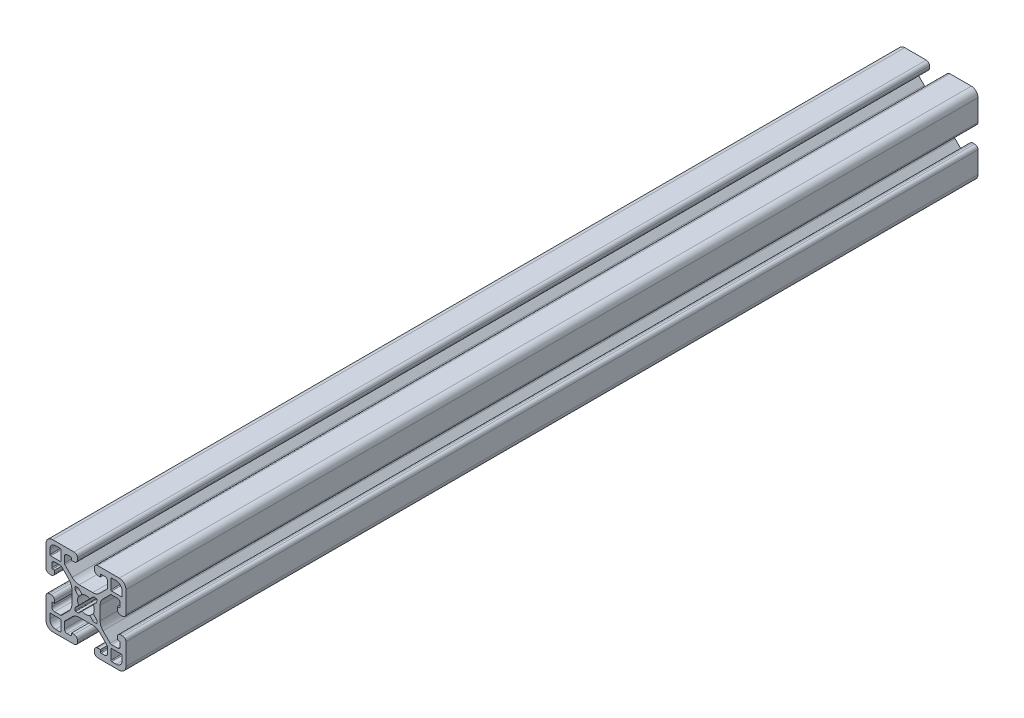
from build123d import *

# Parameters (mm, degrees)
EXTRUDE1_DEPTH      = 406.4
F_7060_RIGHT_D      = 6.6548
F_7060_RIGHT_DEPTH  = 20.1168
F_7060_RIGHT_TIP    = 1.999303624
F_7025_LEFT_D       = 7.9375
F_7025_LEFT_DEPTH   = 23.8252
F_7025_LEFT_TIP     = 2.384665582
SKETCH8_R           = 3.7465
F_7050_R_OPEN_DEPTH = 409.626323897
SKETCH9_R           = 3.7465
F_7050_S_OPEN_DEPTH = 409.626323897


with BuildPart() as part:
    # Sketch1 → Extrude1 (new body)
    with BuildSketch(Plane.XY):
        with BuildLine():
            Line((-16.285872595, 7.239), (-16.285872595, 9.017))
            ThreePointArc((-16.285872595, 9.017), (-15.913898208, 9.915025612), (-15.015872595, 10.287))
            Line((-15.015872595, 10.287), (-12.217800422, 10.287))
            ThreePointArc((-12.217800422, 10.287), (-11.877594851, 10.219328904), (-11.589182494, 10.026617928))
            Line((-11.589182494, 10.026617928), (-8.129198975, 6.56663441))
            ThreePointArc((-8.129198975, 6.56663441), (-7.09957176, 5.025688387), (-6.738014764, 3.20801862))
            Line((-6.738014764, 3.20801862), (-6.738014764, -3.20801862))
            ThreePointArc((-6.738014764, -3.20801862), (-7.09957176, -5.025688387), (-8.129198975, -6.56663441))
            Line((-8.129198975, -6.56663441), (-11.589182494, -10.026617928))
            ThreePointArc((-11.589182494, -10.026617928), (-11.877594851, -10.219328904), (-12.217800422, -10.287))
            Line((-12.217800422, -10.287), (-15.015872595, -10.287))
            ThreePointArc((-15.015872595, -10.287), (-15.913898208, -9.915025612), (-16.285872595, -9.017))
            Line((-16.285872595, -9.017), (-16.285872595, -7.239))
            ThreePointArc((-16.285872595, -7.239), (-16.174280279, -6.969592316), (-15.904872595, -6.858))
            Line((-15.904872595, -6.858), (-14.986, -6.858))
            Line((-14.986, -6.858), (-14.986, -5.6388))
            ThreePointArc((-14.986, -5.6388), (-15.447248241, -4.525248241), (-16.5608, -4.064))
            Line((-16.5608, -4.064), (-17.4752, -4.064))
            ThreePointArc((-17.4752, -4.064), (-18.588751759, -4.525248241), (-19.05, -5.6388))
            Line((-19.05, -5.6388), (-19.05, -15.875))
            ThreePointArc((-19.05, -15.875), (-18.12006403, -18.12006403), (-15.875, -19.05))
            Line((-15.875, -19.05), (-5.6388, -19.05))
            ThreePointArc((-5.6388, -19.05), (-4.525248241, -18.588751759), (-4.064, -17.4752))
            Line((-4.064, -17.4752), (-4.064, -16.5608))
            ThreePointArc((-4.064, -16.5608), (-4.525248241, -15.447248241), (-5.6388, -14.986))
            Line((-5.6388, -14.986), (-6.858, -14.986))
            Line((-6.858, -14.986), (-6.858, -15.904872595))
            ThreePointArc((-6.858, -15.904872595), (-6.969592316, -16.174280279), (-7.239, -16.285872595))
            Line((-7.239, -16.285872595), (-9.017, -16.285872595))
            ThreePointArc((-9.017, -16.285872595), (-9.915025612, -15.913898208), (-10.287, -15.015872595))
            Line((-10.287, -15.015872595), (-10.287, -12.217800422))
            ThreePointArc((-10.287, -12.217800422), (-10.219328904, -11.877594851), (-10.026617928, -11.589182494))
            Line((-10.026617928, -11.589182494), (-6.56663441, -8.129198975))
            ThreePointArc((-6.56663441, -8.129198975), (-5.025688387, -7.09957176), (-3.20801862, -6.738014764))
            Line((-3.20801862, -6.738014764), (3.20801862, -6.738014764))
            ThreePointArc((3.20801862, -6.738014764), (5.025688387, -7.09957176), (6.56663441, -8.129198975))
            Line((6.56663441, -8.129198975), (10.026617928, -11.589182494))
            ThreePointArc((10.026617928, -11.589182494), (10.219328904, -11.877594851), (10.287, -12.217800422))
            Line((10.287, -12.217800422), (10.287, -15.015872595))
            ThreePointArc((10.287, -15.015872595), (9.915025612, -15.913898208), (9.017, -16.285872595))
            Line((9.017, -16.285872595), (7.239, -16.285872595))
            ThreePointArc((7.239, -16.285872595), (6.969592316, -16.174280279), (6.858, -15.904872595))
            Line((6.858, -15.904872595), (6.858, -14.986))
            Line((6.858, -14.986), (5.6388, -14.986))
            ThreePointArc((5.6388, -14.986), (4.525248241, -15.447248241), (4.064, -16.5608))
            Line((4.064, -16.5608), (4.064, -17.4752))
            ThreePointArc((4.064, -17.4752), (4.525248241, -18.588751759), (5.6388, -19.05))
            Line((5.6388, -19.05), (15.875, -19.05))
            ThreePointArc((15.875, -19.05), (18.12006403, -18.12006403), (19.05, -15.875))
            Line((19.05, -15.875), (19.05, -5.6388))
            ThreePointArc((19.05, -5.6388), (18.588751759, -4.525248241), (17.4752, -4.064))
            Line((17.4752, -4.064), (16.5608, -4.064))
            ThreePointArc((16.5608, -4.064), (15.447248241, -4.525248241), (14.986, -5.6388))
            Line((14.986, -5.6388), (14.986, -6.858))
            Line((14.986, -6.858), (15.904872595, -6.858))
            ThreePointArc((15.904872595, -6.858), (16.174280279, -6.969592316), (16.285872595, -7.239))
            Line((16.285872595, -7.239), (16.285872595, -9.017))
            ThreePointArc((16.285872595, -9.017), (15.913898208, -9.915025612), (15.015872595, -10.287))
            Line((15.015872595, -10.287), (12.217800422, -10.287))
            ThreePointArc((12.217800422, -10.287), (11.877594851, -10.219328904), (11.589182494, -10.026617928))
            Line((11.589182494, -10.026617928), (8.129198975, -6.56663441))
            ThreePointArc((8.129198975, -6.56663441), (7.09957176, -5.025688387), (6.738014764, -3.20801862))
            Line((6.738014764, -3.20801862), (6.738014764, 3.20801862))
            ThreePointArc((6.738014764, 3.20801862), (7.09957176, 5.025688387), (8.129198975, 6.56663441))
            Line((8.129198975, 6.56663441), (11.589182494, 10.026617928))
            ThreePointArc((11.589182494, 10.026617928), (11.877594851, 10.219328904), (12.217800422, 10.287))
            Line((12.217800422, 10.287), (15.015872595, 10.287))
            ThreePointArc((15.015872595, 10.287), (15.913898208, 9.915025612), (16.285872595, 9.017))
            Line((16.285872595, 9.017), (16.285872595, 7.239))
            ThreePointArc((16.285872595, 7.239), (16.174280279, 6.969592316), (15.904872595, 6.858))
            Line((15.904872595, 6.858), (14.986, 6.858))
            Line((14.986, 6.858), (14.986, 5.6388))
            ThreePointArc((14.986, 5.6388), (15.447248241, 4.525248241), (16.5608, 4.064))
            Line((16.5608, 4.064), (17.4752, 4.064))
            ThreePointArc((17.4752, 4.064), (18.588751759, 4.525248241), (19.05, 5.6388))
            Line((19.05, 5.6388), (19.05, 15.875))
            ThreePointArc((19.05, 15.875), (18.12006403, 18.12006403), (15.875, 19.05))
            Line((15.875, 19.05), (5.6388, 19.05))
            ThreePointArc((5.6388, 19.05), (4.525248241, 18.588751759), (4.064, 17.4752))
            Line((4.064, 17.4752), (4.064, 16.5608))
            ThreePointArc((4.064, 16.5608), (4.525248241, 15.447248241), (5.6388, 14.986))
            Line((5.6388, 14.986), (6.858, 14.986))
            Line((6.858, 14.986), (6.858, 15.904872595))
            ThreePointArc((6.858, 15.904872595), (6.969592316, 16.174280279), (7.239, 16.285872595))
            Line((7.239, 16.285872595), (9.017, 16.285872595))
            ThreePointArc((9.017, 16.285872595), (9.915025612, 15.913898208), (10.287, 15.015872595))
            Line((10.287, 15.015872595), (10.287, 12.217800422))
            ThreePointArc((10.287, 12.217800422), (10.219328904, 11.877594851), (10.026617928, 11.589182494))
            Line((10.026617928, 11.589182494), (6.56663441, 8.129198975))
            ThreePointArc((6.56663441, 8.129198975), (5.025688387, 7.09957176), (3.20801862, 6.738014764))
            Line((3.20801862, 6.738014764), (-3.20801862, 6.738014764))
            ThreePointArc((-3.20801862, 6.738014764), (-5.025688387, 7.09957176), (-6.56663441, 8.129198975))
            Line((-6.56663441, 8.129198975), (-10.026617928, 11.589182494))
            ThreePointArc((-10.026617928, 11.589182494), (-10.219328904, 11.877594851), (-10.287, 12.217800422))
            Line((-10.287, 12.217800422), (-10.287, 15.015872595))
            ThreePointArc((-10.287, 15.015872595), (-9.915025612, 15.913898208), (-9.017, 16.285872595))
            Line((-9.017, 16.285872595), (-7.239, 16.285872595))
            ThreePointArc((-7.239, 16.285872595), (-6.969592316, 16.174280279), (-6.858, 15.904872595))
            Line((-6.858, 15.904872595), (-6.858, 14.986))
            Line((-6.858, 14.986), (-5.6388, 14.986))
            ThreePointArc((-5.6388, 14.986), (-4.525248241, 15.447248241), (-4.064, 16.5608))
            Line((-4.064, 16.5608), (-4.064, 17.4752))
            ThreePointArc((-4.064, 17.4752), (-4.525248241, 18.588751759), (-5.6388, 19.05))
            Line((-5.6388, 19.05), (-15.875, 19.05))
            ThreePointArc((-15.875, 19.05), (-18.12006403, 18.12006403), (-19.05, 15.875))
            Line((-19.05, 15.875), (-19.05, 5.6388))
            ThreePointArc((-19.05, 5.6388), (-18.588751759, 4.525248241), (-17.4752, 4.064))
            Line((-17.4752, 4.064), (-16.5608, 4.064))
            ThreePointArc((-16.5608, 4.064), (-15.447248241, 4.525248241), (-14.986, 5.6388))
            Line((-14.986, 5.6388), (-14.986, 6.858))
            Line((-14.986, 6.858), (-15.904872595, 6.858))
            ThreePointArc((-15.904872595, 6.858), (-16.174280279, 6.969592316), (-16.285872595, 7.239))
        make_face()
        with BuildLine():
            Line((-12.2428, -17.2466), (-14.4526, -17.2466))
            ThreePointArc((-14.4526, -17.2466), (-16.428256347, -16.428256347), (-17.2466, -14.4526))
            Line((-17.2466, -14.4526), (-17.2466, -12.2428))
            ThreePointArc((-17.2466, -12.2428), (-17.135007684, -11.973392316), (-16.8656, -11.8618))
            Line((-16.8656, -11.8618), (-12.2428, -11.8618))
            ThreePointArc((-12.2428, -11.8618), (-11.973392316, -11.973392316), (-11.8618, -12.2428))
            Line((-11.8618, -12.2428), (-11.8618, -16.8656))
            ThreePointArc((-11.8618, -16.8656), (-11.973392316, -17.135007684), (-12.2428, -17.2466))
        make_face(mode=Mode.SUBTRACT)
        with BuildLine():
            Line((12.2428, 17.2466), (14.4526, 17.2466))
            ThreePointArc((14.4526, 17.2466), (16.428256347, 16.428256347), (17.2466, 14.4526))
            Line((17.2466, 14.4526), (17.2466, 12.2428))
            ThreePointArc((17.2466, 12.2428), (17.135007684, 11.973392316), (16.8656, 11.8618))
            Line((16.8656, 11.8618), (12.2428, 11.8618))
            ThreePointArc((12.2428, 11.8618), (11.973392316, 11.973392316), (11.8618, 12.2428))
            Line((11.8618, 12.2428), (11.8618, 16.8656))
            ThreePointArc((11.8618, 16.8656), (11.973392316, 17.135007684), (12.2428, 17.2466))
        make_face(mode=Mode.SUBTRACT)
        with BuildLine():
            Line((1.582347442, 3.198793543), (3.304771827, 4.921217928))
            ThreePointArc((3.304771827, 4.921217928), (3.593184184, 5.113928904), (3.933389755, 5.1816))
            Line((3.933389755, 5.1816), (4.9276, 5.1816))
            ThreePointArc((4.9276, 5.1816), (5.107205122, 5.107205122), (5.1816, 4.9276))
            Line((5.1816, 4.9276), (5.1816, 3.933389755))
            ThreePointArc((5.1816, 3.933389755), (5.113928904, 3.593184184), (4.921217928, 3.304771827))
            Line((4.921217928, 3.304771827), (3.198793543, 1.582347442))
            ThreePointArc((3.198793543, 1.582347442), (3.095711236, 1.393016011), (3.111879183, 1.178048687))
            ThreePointArc((3.111879183, 1.178048687), (3.3274, 0), (3.111879183, -1.178048687))
            ThreePointArc((3.111879183, -1.178048687), (3.095711236, -1.393016011), (3.198793543, -1.582347442))
            Line((3.198793543, -1.582347442), (4.921217928, -3.304771827))
            ThreePointArc((4.921217928, -3.304771827), (5.113928904, -3.593184184), (5.1816, -3.933389755))
            Line((5.1816, -3.933389755), (5.1816, -4.9276))
            ThreePointArc((5.1816, -4.9276), (5.107205122, -5.107205122), (4.9276, -5.1816))
            Line((4.9276, -5.1816), (3.933389755, -5.1816))
            ThreePointArc((3.933389755, -5.1816), (3.593184184, -5.113928904), (3.304771827, -4.921217928))
            Line((3.304771827, -4.921217928), (1.582347442, -3.198793543))
            ThreePointArc((1.582347442, -3.198793543), (1.393016011, -3.095711236), (1.178048687, -3.111879183))
            ThreePointArc((1.178048687, -3.111879183), (0, -3.3274), (-1.178048687, -3.111879183))
            ThreePointArc((-1.178048687, -3.111879183), (-1.393016011, -3.095711236), (-1.582347442, -3.198793543))
            Line((-1.582347442, -3.198793543), (-3.304771827, -4.921217928))
            ThreePointArc((-3.304771827, -4.921217928), (-3.593184184, -5.113928904), (-3.933389755, -5.1816))
            Line((-3.933389755, -5.1816), (-4.9276, -5.1816))
            ThreePointArc((-4.9276, -5.1816), (-5.107205122, -5.107205122), (-5.1816, -4.9276))
            Line((-5.1816, -4.9276), (-5.1816, -3.933389755))
            ThreePointArc((-5.1816, -3.933389755), (-5.113928904, -3.593184184), (-4.921217928, -3.304771827))
            Line((-4.921217928, -3.304771827), (-3.198793543, -1.582347442))
            ThreePointArc((-3.198793543, -1.582347442), (-3.095711236, -1.393016011), (-3.111879183, -1.178048687))
            ThreePointArc((-3.111879183, -1.178048687), (-3.3274, 0), (-3.111879183, 1.178048687))
            ThreePointArc((-3.111879183, 1.178048687), (-3.095711236, 1.393016011), (-3.198793543, 1.582347442))
            Line((-3.198793543, 1.582347442), (-4.921217928, 3.304771827))
            ThreePointArc((-4.921217928, 3.304771827), (-5.113928904, 3.593184184), (-5.1816, 3.933389755))
            Line((-5.1816, 3.933389755), (-5.1816, 4.9276))
            ThreePointArc((-5.1816, 4.9276), (-5.107205122, 5.107205122), (-4.9276, 5.1816))
            Line((-4.9276, 5.1816), (-3.933389755, 5.1816))
            ThreePointArc((-3.933389755, 5.1816), (-3.593184184, 5.113928904), (-3.304771827, 4.921217928))
            Line((-3.304771827, 4.921217928), (-1.582347442, 3.198793543))
            ThreePointArc((-1.582347442, 3.198793543), (-1.393016011, 3.095711236), (-1.178048687, 3.111879183))
            ThreePointArc((-1.178048687, 3.111879183), (0, 3.3274), (1.178048687, 3.111879183))
            ThreePointArc((1.178048687, 3.111879183), (1.393016011, 3.095711236), (1.582347442, 3.198793543))
        make_face(mode=Mode.SUBTRACT)
        with BuildLine():
            Line((-17.2466, 12.2428), (-17.2466, 14.4526))
            ThreePointArc((-17.2466, 14.4526), (-16.428256347, 16.428256347), (-14.4526, 17.2466))
            Line((-14.4526, 17.2466), (-12.2428, 17.2466))
            ThreePointArc((-12.2428, 17.2466), (-11.973392316, 17.135007684), (-11.8618, 16.8656))
            Line((-11.8618, 16.8656), (-11.8618, 12.2428))
            ThreePointArc((-11.8618, 12.2428), (-11.973392316, 11.973392316), (-12.2428, 11.8618))
            Line((-12.2428, 11.8618), (-16.8656, 11.8618))
            ThreePointArc((-16.8656, 11.8618), (-17.135007684, 11.973392316), (-17.2466, 12.2428))
        make_face(mode=Mode.SUBTRACT)
        with BuildLine():
            Line((17.2466, -12.2428), (17.2466, -14.4526))
            ThreePointArc((17.2466, -14.4526), (16.428256347, -16.428256347), (14.4526, -17.2466))
            Line((14.4526, -17.2466), (12.2428, -17.2466))
            ThreePointArc((12.2428, -17.2466), (11.973392316, -17.135007684), (11.8618, -16.8656))
            Line((11.8618, -16.8656), (11.8618, -12.2428))
            ThreePointArc((11.8618, -12.2428), (11.973392316, -11.973392316), (12.2428, -11.8618))
            Line((12.2428, -11.8618), (16.8656, -11.8618))
            ThreePointArc((16.8656, -11.8618), (17.135007684, -11.973392316), (17.2466, -12.2428))
        make_face(mode=Mode.SUBTRACT)
    extrude(amount=-EXTRUDE1_DEPTH)

    # 7060-RIGHT
    with Locations(Plane(origin=(0, 0, -406.4), x_dir=(-1, 0, 0), z_dir=(0, 0, -1))):
        with Locations((0, 0)):
            Hole(F_7060_RIGHT_D / 2, depth=F_7060_RIGHT_DEPTH)
            with Locations((0, 0, -(F_7060_RIGHT_DEPTH + F_7060_RIGHT_TIP / 2))):  # 118° drill point
                Cone(0, F_7060_RIGHT_D / 2, F_7060_RIGHT_TIP, mode=Mode.SUBTRACT)

    # 7025-LEFT
    with Locations(Plane.XY):
        with Locations((0, 0)):
            Hole(F_7025_LEFT_D / 2, depth=F_7025_LEFT_DEPTH)
            with Locations((0, 0, -(F_7025_LEFT_DEPTH + F_7025_LEFT_TIP / 2))):  # 118° drill point
                Cone(0, F_7025_LEFT_D / 2, F_7025_LEFT_TIP, mode=Mode.SUBTRACT)

    # Sketch8 → 7050-R-OPEN (cut, through all)
    with BuildSketch(Plane(origin=(0, 19.05, 0), x_dir=(-1, 0, 0), z_dir=(0, 1, 0))):
        with Locations(Location((0, -171.45, 0), (0, 0, 71.673002029))):
            Circle(SKETCH8_R)
    extrude(amount=-F_7050_R_OPEN_DEPTH, mode=Mode.SUBTRACT)

    # Sketch9 → 7050-S-OPEN (cut, through all)
    with BuildSketch(Plane(origin=(19.05, 0, 0), x_dir=(0, 0, -1), z_dir=(1, 0, 0))):
        with Locations(Location((273.05, 0, 0), (0, 0, 341.673002029))):
            Circle(SKETCH9_R)
    extrude(amount=-F_7050_S_OPEN_DEPTH, mode=Mode.SUBTRACT)


solid = part.part
